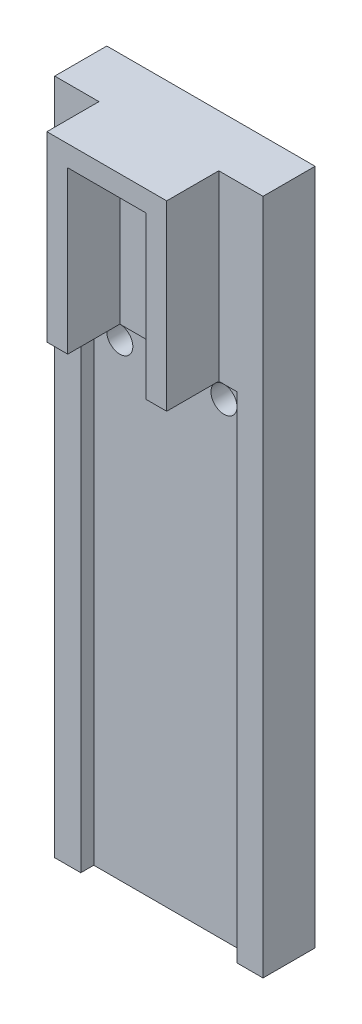
from build123d import *

# Parameters (mm, degrees)
SKETCH1_W               = 25.4
SKETCH1_H               = 82.55
BOSS_EXTRUDE1_DEPTH     = 6.35
SKETCH2_R               = 1.5875
CUT_EXTRUDE1_DEPTH      = 44.649033494
SKETCH3_W               = 19.05
SKETCH3_H               = 60.325
CUT_EXTRUDE2_DEPTH      = 1.5875
CUT_EXTRUDE3_DEPTH      = 44.649033494
CUT_EXTRUDE3_DEPTH_BACK = 44.649033494
SKETCH5_W               = 9.525
SKETCH5_H               = 6.35
BOSS_EXTRUDE2_DEPTH     = 6.35


with BuildPart() as part:
    # Sketch1 → Boss-Extrude1 (new body)
    with BuildSketch(Plane.XY):
        Rectangle(SKETCH1_W, SKETCH1_H)
    extrude(amount=BOSS_EXTRUDE1_DEPTH)

    # Sketch2 → Cut-Extrude1 (cut, through all)
    with BuildSketch(Plane.XY.offset(6.35)):
        with Locations((-6.35, 15.875)):
            Circle(SKETCH2_R)
        with Locations(Location((6.35, 15.875, 0), (0, 0, 180))):
            Circle(SKETCH2_R)
    extrude(amount=-CUT_EXTRUDE1_DEPTH, mode=Mode.SUBTRACT)

    # Sketch3 → Cut-Extrude2 (cut)
    with BuildSketch(Plane.XY.offset(6.35)):
        with Locations((0, -11.1125)):
            Rectangle(SKETCH3_W, SKETCH3_H)
    extrude(amount=-CUT_EXTRUDE2_DEPTH, mode=Mode.SUBTRACT)

    # Sketch5 → Cut-Extrude3 (cut, two sides: drawn at the far end of the back side and taken through both)
    with BuildSketch(Plane.XY.offset(6.35).offset(-CUT_EXTRUDE3_DEPTH_BACK)):
        with Locations((0, 35.56)):
            Rectangle(SKETCH5_W, SKETCH5_H)
    extrude(amount=CUT_EXTRUDE3_DEPTH + CUT_EXTRUDE3_DEPTH_BACK, mode=Mode.SUBTRACT)

    # Sketch6 → Boss-Extrude2 (add)
    with BuildSketch(Plane.XY.offset(6.35)):
        Polygon((-7.3025, 41.275), (7.3025, 41.275), (7.3025, 19.05), (4.7625, 19.05), (4.7625, 38.735), (-4.7625, 38.735), (-4.7625, 19.05), (-7.3025, 19.05), align=None)
    extrude(amount=BOSS_EXTRUDE2_DEPTH)


solid = part.part
